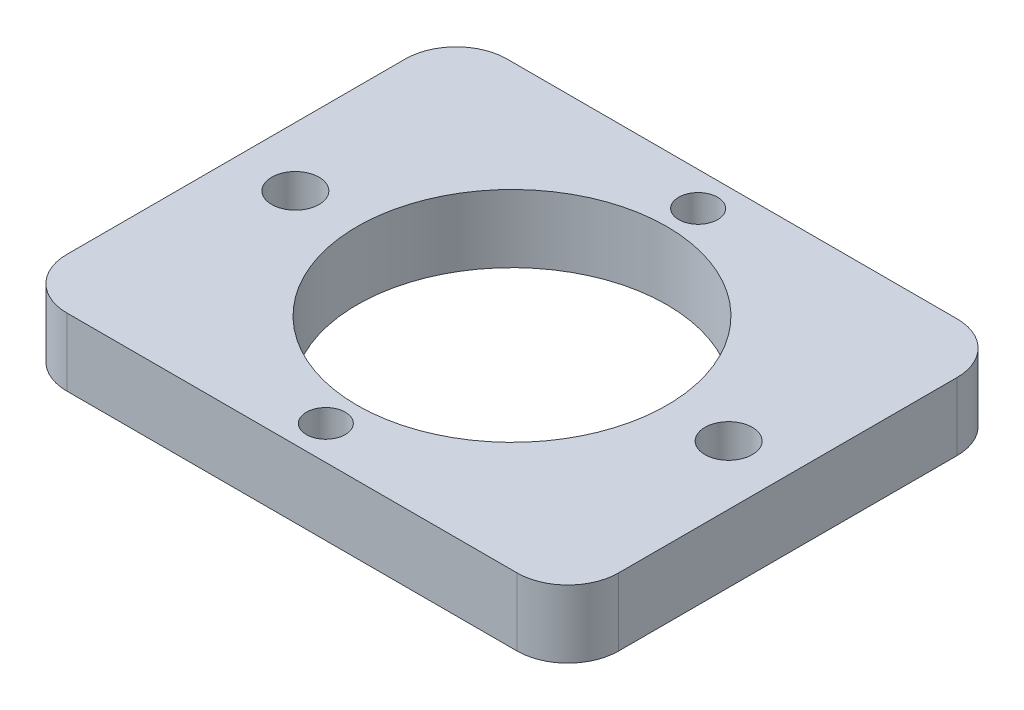
from build123d import *

# Parameters (mm, degrees)
SKETCH1_W           = 32.6
SKETCH1_H           = 26
BOSS_EXTRUDE1_DEPTH = 4
SKETCH2_R           = 9.15
SKETCH2_R_2         = 1.4
SKETCH2_R_3         = 1.15
CUT_EXTRUDE1_DEPTH  = 4
FILLET1_R           = 3


with BuildPart() as part:
    # Sketch1 → Boss-Extrude1 (new body)
    with BuildSketch(Plane(origin=(0, 0, 0), x_dir=(1, 0, 0), z_dir=(0, 1, 0))):
        with Locations((16.3, -13)):
            Rectangle(SKETCH1_W, SKETCH1_H)
    extrude(amount=BOSS_EXTRUDE1_DEPTH)

    # Sketch2 → Cut-Extrude1 (cut)
    with BuildSketch(Plane(origin=(0, 4, 0), x_dir=(1, 0, 0), z_dir=(0, 1, 0))):
        with Locations(Location((16.3, -13, 0), (0, 0, 270))):
            Circle(SKETCH2_R)
        with Locations(Location((3.5, -13, 0), (0, 0, 270))):
            Circle(SKETCH2_R_2)
        with Locations(Location((29.1, -13, 0), (0, 0, 270))):
            Circle(SKETCH2_R_2)
        with Locations(Location((16.3, -2, 0), (0, 0, 270))):
            Circle(SKETCH2_R_3)
        with Locations(Location((16.3, -24, 0), (0, 0, 270))):
            Circle(SKETCH2_R_3)
    extrude(amount=-CUT_EXTRUDE1_DEPTH, mode=Mode.SUBTRACT)

    # Fillet1
    fillet1_edges = [part.edges().sort_by_distance(p)[0] for p in [
        (0, 2, 0),
        (32.6, 2, 0),
        (32.6, 2, 26),
        (0, 2, 26),
    ]]
    fillet(fillet1_edges, radius=FILLET1_R)


solid = part.part
